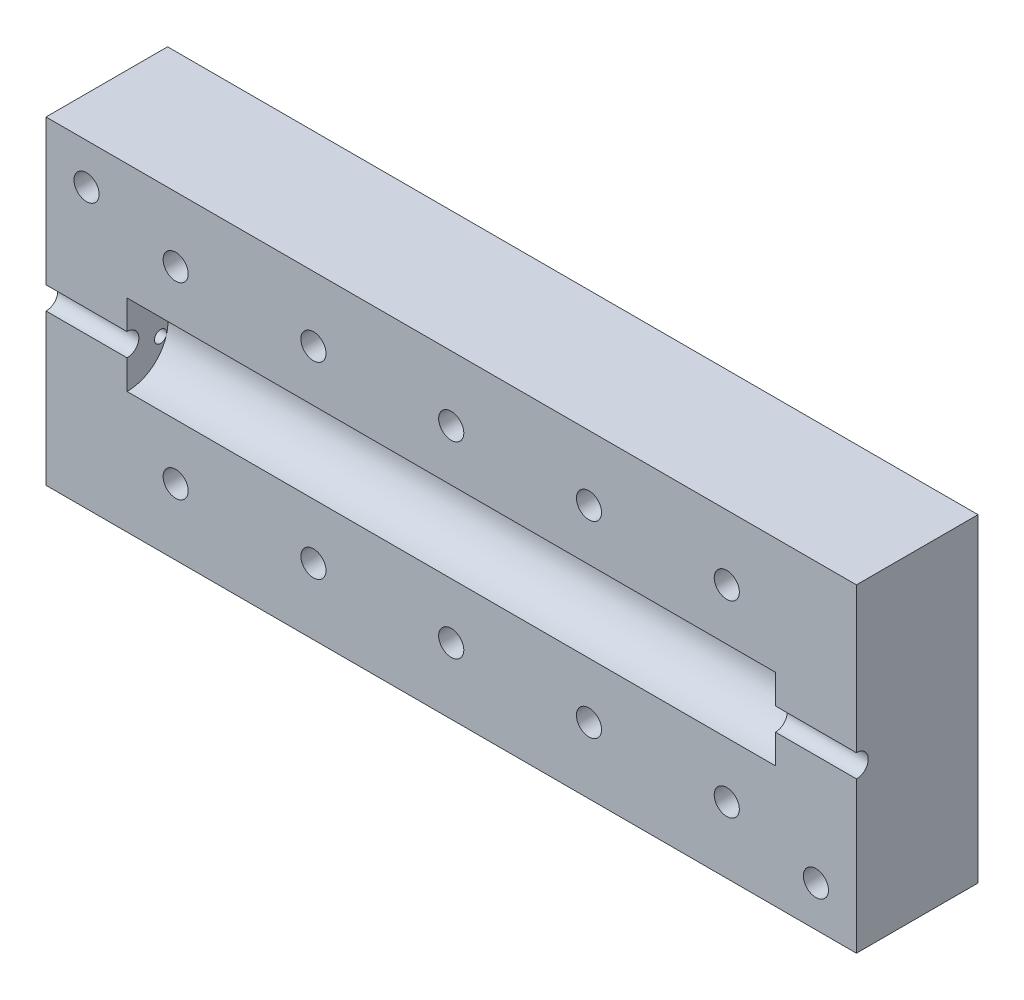
from build123d import *

# Parameters (mm, degrees)
SKIZZE2_W                            = 100
SKIZZE2_H                            = 39.364160046
AUFSATZ_LINEAR_AUSTRAGEN1_DEPTH      = 30
SCHNITT_LINEAR_AUSTRAGEN1_DEPTH      = 40
SCHNITT_LINEAR_AUSTRAGEN1_DEPTH_BACK = 40
SKIZZE10_R                           = 5
SKIZZE17_R                           = 1.4
SCHNITT_LINEAR_AUSTRAGEN2_DEPTH      = 103.710939516
SKIZZE24_R                           = 1.55
SCHNITT_LINEAR_AUSTRAGEN4_DEPTH      = 112.577493681
SKIZZE37_R                           = 0.736865544
SCHNITT_LINEAR_AUSTRAGEN9_DEPTH      = 112.577493681
SKIZZE40_R                           = 2.1
SCHNITT_LINEAR_AUSTRAGEN10_DEPTH     = 6
SKIZZE42_R                           = 0.75
SCHNITT_LINEAR_AUSTRAGEN12_DEPTH     = 10
VERRUNDUNG1_R                        = 1
SKIZZE46_R                           = 2.85
SCHNITT_LINEAR_AUSTRAGEN15_DEPTH     = 10
SCHNITT_LINEAR_START                 = -5
SCHNITT_LINEAR_AUSTRAGEN25_DEPTH     = 2.7
LINEARES_MUSTER1_COUNT               = 5
LINEARES_MUSTER1_PITCH               = 17
SPIEGELN2_COPY_1_SKETCH_R            = 2.85
SPIEGELN2_COPY_1_DEPTH               = 10
SPIEGELN2_COPY_2_SKETCH_R            = 2.85
SPIEGELN2_COPY_2_DEPTH               = 10
SPIEGELN2_COPY_3_SKETCH_R            = 2.85
SPIEGELN2_COPY_3_DEPTH               = 10
SPIEGELN2_COPY_4_SKETCH_R            = 2.85
SPIEGELN2_COPY_4_DEPTH               = 10
SPIEGELN2_START                      = -5
SPIEGELN2_COPY_5_DEPTH               = 2.7
SPIEGELN2_COPY_6_DEPTH               = 2.7
SPIEGELN2_COPY_7_DEPTH               = 2.7
SPIEGELN2_COPY_8_DEPTH               = 2.7
SCHNITT_LINEAR_START_2               = -10
SKIZZE51_R                           = 1.55
SCHNITT_LINEAR_AUSTRAGEN26_DEPTH     = 10
SKIZZE52_W                           = 15
SKIZZE52_H                           = 39.364160046
SCHNITT_LINEAR_AUSTRAGEN27_DEPTH     = 112.577493681


with BuildPart() as part:
    # Skizze2 → Aufsatz-Linear austragen1 (new body)
    with BuildSketch(Plane.XY):
        with Locations((50, 19.682080023)):
            Rectangle(SKIZZE2_W, SKIZZE2_H)
    extrude(amount=AUFSATZ_LINEAR_AUSTRAGEN1_DEPTH)

    # Skizze10 → Schnitt-Linear austragen1 (cut, two sides: drawn at the far end of the back side and taken through both)
    with BuildSketch(Plane.ZY.offset(-50).offset(-SCHNITT_LINEAR_AUSTRAGEN1_DEPTH_BACK)):
        with Locations((14.945770016, 20.027045739)):
            Circle(SKIZZE10_R)
    extrude(amount=SCHNITT_LINEAR_AUSTRAGEN1_DEPTH + SCHNITT_LINEAR_AUSTRAGEN1_DEPTH_BACK, mode=Mode.SUBTRACT)

    # Skizze17 → Schnitt-Linear austragen2 (cut, through all)
    with BuildSketch(Plane.ZY.offset(-90)):
        with Locations((14.945770016, 20.027045739)):
            Circle(SKIZZE17_R)
    schnitt_linear_austragen2 = extrude(amount=-SCHNITT_LINEAR_AUSTRAGEN2_DEPTH, mode=Mode.SUBTRACT)

    # Spiegeln1: Schnitt-Linear austragen2 across plane
    add(schnitt_linear_austragen2.mirror(Plane.ZY.offset(-50)), mode=Mode.SUBTRACT)

    # Skizze24 → Schnitt-Linear austragen4 (cut, through all)
    with BuildSketch(Plane.XY.offset(30)):
        with Locations((16, 31.364160046)):
            Circle(SKIZZE24_R)
        with Locations((33, 31.364160046)):
            Circle(SKIZZE24_R)
        with Locations((50, 31.364160046)):
            Circle(SKIZZE24_R)
        with Locations((67, 31.364160046)):
            Circle(SKIZZE24_R)
        with Locations((84, 31.364160046)):
            Circle(SKIZZE24_R)
    schnitt_linear_austragen4 = extrude(amount=-SCHNITT_LINEAR_AUSTRAGEN4_DEPTH, mode=Mode.SUBTRACT)

    # Skizze37 → Schnitt-Linear austragen9 (cut, through all)
    with BuildSketch(Plane(origin=(100, 0, 0), x_dir=(0, 0, -1), z_dir=(1, 0, 0))):
        with Locations((-18.924590299, 18.633559666)):
            Circle(SKIZZE37_R)
    extrude(amount=-SCHNITT_LINEAR_AUSTRAGEN9_DEPTH, mode=Mode.SUBTRACT)

    # Skizze40 → Schnitt-Linear austragen10 (cut)
    with BuildSketch(Plane(origin=(100, 0, 0), x_dir=(0, 0, -1), z_dir=(1, 0, 0))):
        with Locations((-18.924590299, 18.633559666)):
            Circle(SKIZZE40_R)
    extrude(amount=-SCHNITT_LINEAR_AUSTRAGEN10_DEPTH, mode=Mode.SUBTRACT)

    # Skizze42 → Schnitt-Linear austragen12 (cut)
    with BuildSketch(Plane.ZY):
        with Locations((10.86415918, 18.842582577)):
            Circle(SKIZZE42_R)
    extrude(amount=-SCHNITT_LINEAR_AUSTRAGEN12_DEPTH, mode=Mode.SUBTRACT)

    # Verrundung1
    verrundung1_edges = [part.edges().sort_by_distance(p)[0] for p in [
        (94, 18.633559666, 19.661455843),
    ]]
    fillet(verrundung1_edges, radius=VERRUNDUNG1_R)

    # Skizze46 → Schnitt-Linear austragen15 (cut)
    with BuildSketch(Plane(origin=(0, 0, 0), x_dir=(-1, 0, 0), z_dir=(0, 0, -1))):
        with Locations((-84, 31.364160046)):
            Circle(SKIZZE46_R)
    schnitt_linear_austragen15 = extrude(amount=-SCHNITT_LINEAR_AUSTRAGEN15_DEPTH, mode=Mode.SUBTRACT)

    # Skizze50 → Schnitt-Linear austragen25 (cut)
    with BuildSketch(Plane.XY.offset(30).offset(SCHNITT_LINEAR_START)):
        Polygon((81.15, 33.009608314), (81.15, 39.364160046), (86.85, 39.364160046), (86.85, 33.009608314), (86.85, 29.718711779), (84, 28.073263512), (81.15, 29.718711779), align=None)
    schnitt_linear_austragen25 = extrude(amount=-SCHNITT_LINEAR_AUSTRAGEN25_DEPTH, mode=Mode.SUBTRACT)

    # Lineares Muster1: Schnitt-Linear austragen15, Schnitt-Linear austragen25 ×5
    with Locations(*[(-i * LINEARES_MUSTER1_PITCH, 0, 0) for i in range(1, LINEARES_MUSTER1_COUNT)]):
        add(schnitt_linear_austragen15, mode=Mode.SUBTRACT)
        add(schnitt_linear_austragen25, mode=Mode.SUBTRACT)

    # Spiegeln2: Schnitt-Linear austragen15, Schnitt-Linear austragen25 across plane
    add(schnitt_linear_austragen15.mirror(Plane.ZX.offset(19.764160046)), mode=Mode.SUBTRACT)
    add(schnitt_linear_austragen25.mirror(Plane.ZX.offset(19.764160046)), mode=Mode.SUBTRACT)

    # Spiegeln2 copy 1 sketch → Spiegeln2 copy 1 (cut)
    with BuildSketch(Plane(origin=(-17, 39.528320093, 0), x_dir=(-1, 0, 0), z_dir=(0, 0, -1))):
        with Locations((-84, -31.364160046)):
            Circle(SPIEGELN2_COPY_1_SKETCH_R)
    extrude(amount=-SPIEGELN2_COPY_1_DEPTH, mode=Mode.SUBTRACT)

    # Spiegeln2 copy 2 sketch → Spiegeln2 copy 2 (cut)
    with BuildSketch(Plane(origin=(-34, 39.528320093, 0), x_dir=(-1, 0, 0), z_dir=(0, 0, -1))):
        with Locations((-84, -31.364160046)):
            Circle(SPIEGELN2_COPY_2_SKETCH_R)
    extrude(amount=-SPIEGELN2_COPY_2_DEPTH, mode=Mode.SUBTRACT)

    # Spiegeln2 copy 3 sketch → Spiegeln2 copy 3 (cut)
    with BuildSketch(Plane(origin=(-51, 39.528320093, 0), x_dir=(-1, 0, 0), z_dir=(0, 0, -1))):
        with Locations((-84, -31.364160046)):
            Circle(SPIEGELN2_COPY_3_SKETCH_R)
    extrude(amount=-SPIEGELN2_COPY_3_DEPTH, mode=Mode.SUBTRACT)

    # Spiegeln2 copy 4 sketch → Spiegeln2 copy 4 (cut)
    with BuildSketch(Plane(origin=(-68, 39.528320093, 0), x_dir=(-1, 0, 0), z_dir=(0, 0, -1))):
        with Locations((-84, -31.364160046)):
            Circle(SPIEGELN2_COPY_4_SKETCH_R)
    extrude(amount=-SPIEGELN2_COPY_4_DEPTH, mode=Mode.SUBTRACT)

    # Spiegeln2 copy 5 sketch → Spiegeln2 copy 5 (cut)
    with BuildSketch(Plane(origin=(-17, 39.528320093, 30), x_dir=(1, 0, 0), z_dir=(0, 0, 1)).offset(SPIEGELN2_START)):
        Polygon((81.15, -33.009608314), (81.15, -39.364160046), (86.85, -39.364160046), (86.85, -33.009608314), (86.85, -29.718711779), (84, -28.073263512), (81.15, -29.718711779), align=None)
    extrude(amount=-SPIEGELN2_COPY_5_DEPTH, mode=Mode.SUBTRACT)

    # Spiegeln2 copy 6 sketch → Spiegeln2 copy 6 (cut)
    with BuildSketch(Plane(origin=(-34, 39.528320093, 30), x_dir=(1, 0, 0), z_dir=(0, 0, 1)).offset(SPIEGELN2_START)):
        Polygon((81.15, -33.009608314), (81.15, -39.364160046), (86.85, -39.364160046), (86.85, -33.009608314), (86.85, -29.718711779), (84, -28.073263512), (81.15, -29.718711779), align=None)
    extrude(amount=-SPIEGELN2_COPY_6_DEPTH, mode=Mode.SUBTRACT)

    # Spiegeln2 copy 7 sketch → Spiegeln2 copy 7 (cut)
    with BuildSketch(Plane(origin=(-51, 39.528320093, 30), x_dir=(1, 0, 0), z_dir=(0, 0, 1)).offset(SPIEGELN2_START)):
        Polygon((81.15, -33.009608314), (81.15, -39.364160046), (86.85, -39.364160046), (86.85, -33.009608314), (86.85, -29.718711779), (84, -28.073263512), (81.15, -29.718711779), align=None)
    extrude(amount=-SPIEGELN2_COPY_7_DEPTH, mode=Mode.SUBTRACT)

    # Spiegeln2 copy 8 sketch → Spiegeln2 copy 8 (cut)
    with BuildSketch(Plane(origin=(-68, 39.528320093, 30), x_dir=(1, 0, 0), z_dir=(0, 0, 1)).offset(SPIEGELN2_START)):
        Polygon((81.15, -33.009608314), (81.15, -39.364160046), (86.85, -39.364160046), (86.85, -33.009608314), (86.85, -29.718711779), (84, -28.073263512), (81.15, -29.718711779), align=None)
    extrude(amount=-SPIEGELN2_COPY_8_DEPTH, mode=Mode.SUBTRACT)

    # Spiegeln3: Schnitt-Linear austragen4 across plane
    add(schnitt_linear_austragen4.mirror(Plane.ZX.offset(19.764160046)), mode=Mode.SUBTRACT)

    # Skizze51 → Schnitt-Linear austragen26 (cut)
    with BuildSketch(Plane.XY.offset(30).offset(SCHNITT_LINEAR_START_2)):
        with Locations((5, 34.364160046)):
            Circle(SKIZZE51_R)
        with Locations((95, 5)):
            Circle(SKIZZE51_R)
    extrude(amount=-SCHNITT_LINEAR_AUSTRAGEN26_DEPTH, mode=Mode.SUBTRACT)

    # Skizze52 → Schnitt-Linear austragen27 (cut, through all)
    with BuildSketch(Plane.ZY):
        with Locations((22.5, 19.682080023)):
            Rectangle(SKIZZE52_W, SKIZZE52_H)
    extrude(amount=-SCHNITT_LINEAR_AUSTRAGEN27_DEPTH, mode=Mode.SUBTRACT)


solid = part.part
